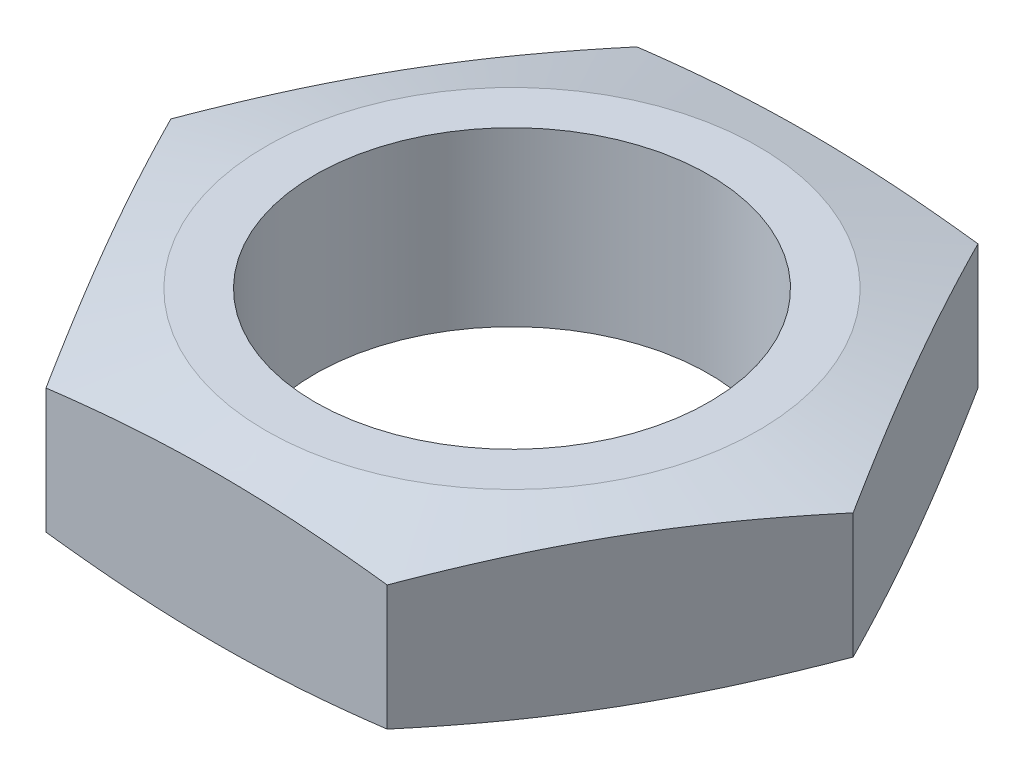
from build123d import *

# Parameters (mm, degrees)
SKETCH_1_R      = 4
EXTRUDE_1_DEPTH = 3.5


with BuildPart() as part:
    # 草图1 → 凸台-拉伸1 (new body)
    with BuildSketch(Plane(origin=(0, 0, 0), x_dir=(1, 0, 0), z_dir=(0, 1, 0))):
        Polygon((6.92820323, 0), (3.464101615, 6), (-3.464101615, 6), (-6.92820323, 0), (-3.464101615, -6), (3.464101615, -6), align=None)
        with Locations(Location((0, 0, 0), (0, 0, 270))):
            Circle(SKETCH_1_R, mode=Mode.SUBTRACT)
    extrude(amount=EXTRUDE_1_DEPTH)

    # 草图2 → 切除-旋转1 (revolve, cut)
    with BuildSketch(Plane(origin=(0, 0, 0), x_dir=(0, 0, -1), z_dir=(1, 0, 0)), mode=Mode.PRIVATE) as cut_revolve_1_sk:
        Polygon((-5, 3.5), (-9, 3.5), (-9, 2.5), align=None)
        Polygon((-9, 1), (-5, 0), (-9, 0), align=None)
    revolve(cut_revolve_1_sk.sketch.rotate(Axis((0, 3.5, 0), (0, -1, 0)), 209.99999999), axis=Axis((0, 3.5, 0), (0, -1, 0)), mode=Mode.SUBTRACT)


solid = part.part
